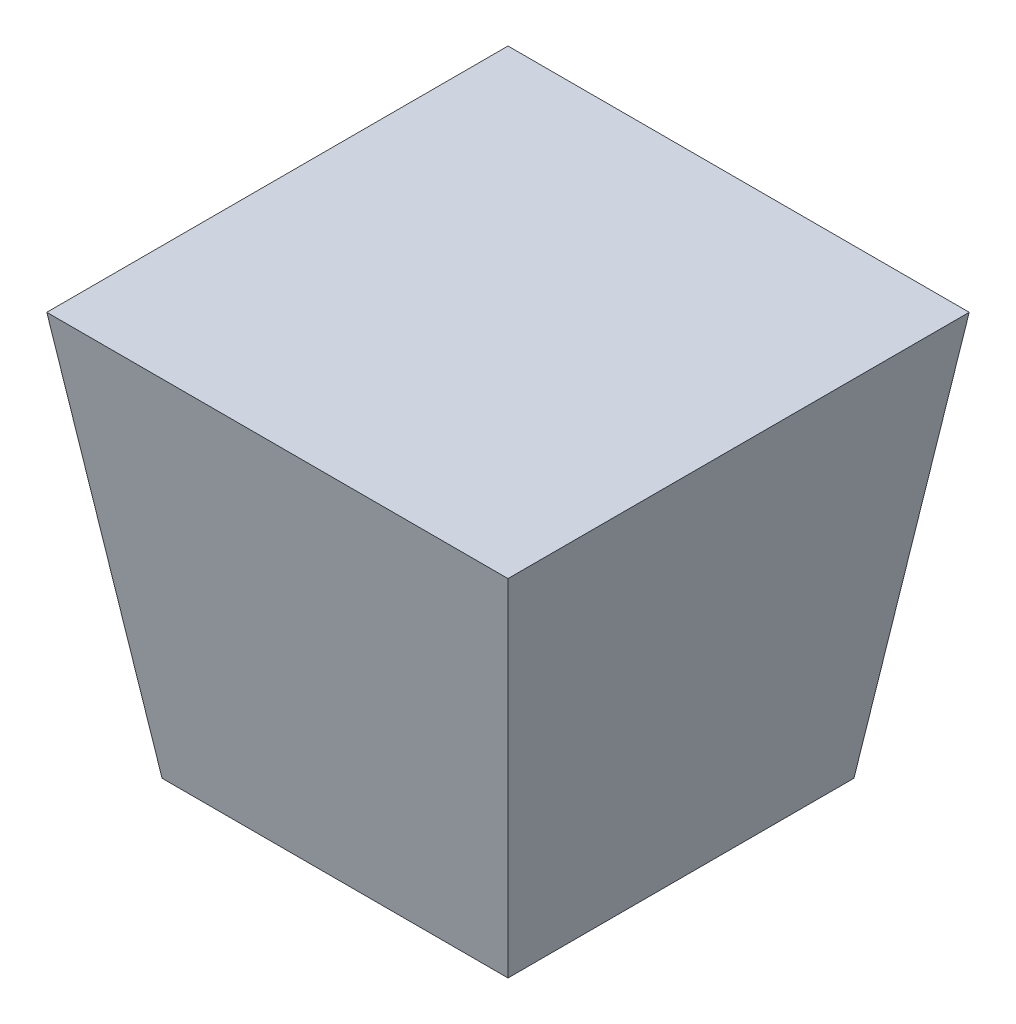
from build123d import *

# Parameters (mm, degrees)
SKETCH_1_W          = 40
SKETCH_1_H          = 40
EXTRUDE_1_DEPTH     = 40
CUT_EXTRUDE_1_DEPTH = 77.035731628
CUT_EXTRUDE_2_DEPTH = 62.629021291


with BuildPart() as part:
    # Эскиз1 → Бобышка-Вытянуть1 (new body)
    with BuildSketch(Plane(origin=(0, 0, 0), x_dir=(1, 0, 0), z_dir=(0, 1, 0))):
        with Locations((-30.807799443, -4.456824513)):
            Rectangle(SKETCH_1_W, SKETCH_1_H)
    extrude(amount=EXTRUDE_1_DEPTH)

    # Эскиз2 → Вырез-Вытянуть1 (cut, through all)
    with BuildSketch(Plane(origin=(0, 0, -15.543175487), x_dir=(-1, 0, 0), z_dir=(0, 0, -1))):
        Polygon((10.807799443, 40), (10.807799443, 0), (20.807799443, 0), align=None)
    extrude(amount=-CUT_EXTRUDE_1_DEPTH, mode=Mode.SUBTRACT)

    # Эскиз3 → Вырез-Вытянуть2 (cut, through all)
    with BuildSketch(Plane.ZY.offset(50.807799443)):
        Polygon((24.456824513, 0), (14.456824513, 0), (24.456824513, 40), align=None)
    extrude(amount=-CUT_EXTRUDE_2_DEPTH, mode=Mode.SUBTRACT)


solid = part.part
